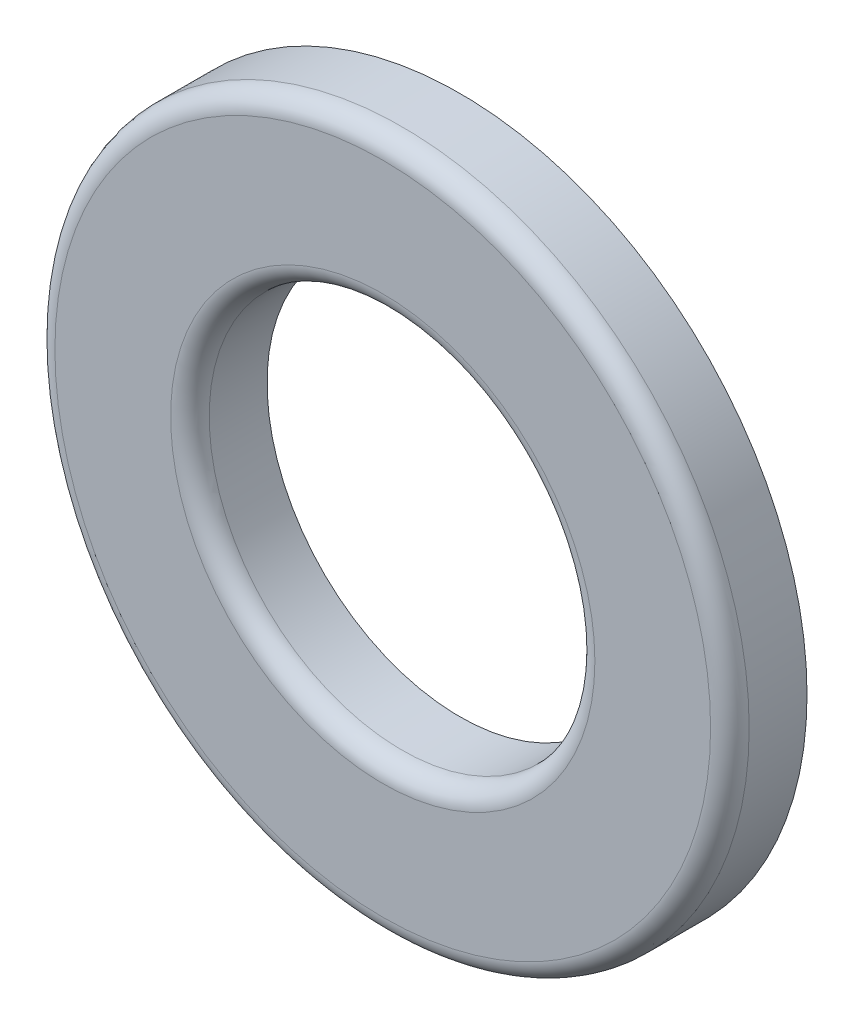
from build123d import *

# Parameters (mm, degrees)
SKETCH1_R           = 4.5
SKETCH1_R_2         = 2.5
BOSS_EXTRUDE1_DEPTH = 1
FILLET1_R           = 0.25


with BuildPart() as part:
    # Sketch1 → Boss-Extrude1 (new body)
    with BuildSketch(Plane.XY):
        Circle(SKETCH1_R)
        Circle(SKETCH1_R_2, mode=Mode.SUBTRACT)
    extrude(amount=BOSS_EXTRUDE1_DEPTH)

    # Fillet1
    fillet1_edges = [part.edges().sort_by_distance(p)[0] for p in [
        (-4.5, 0, 1),
        (-2.5, 0, 1),
    ]]
    fillet(fillet1_edges, radius=FILLET1_R)


solid = part.part
